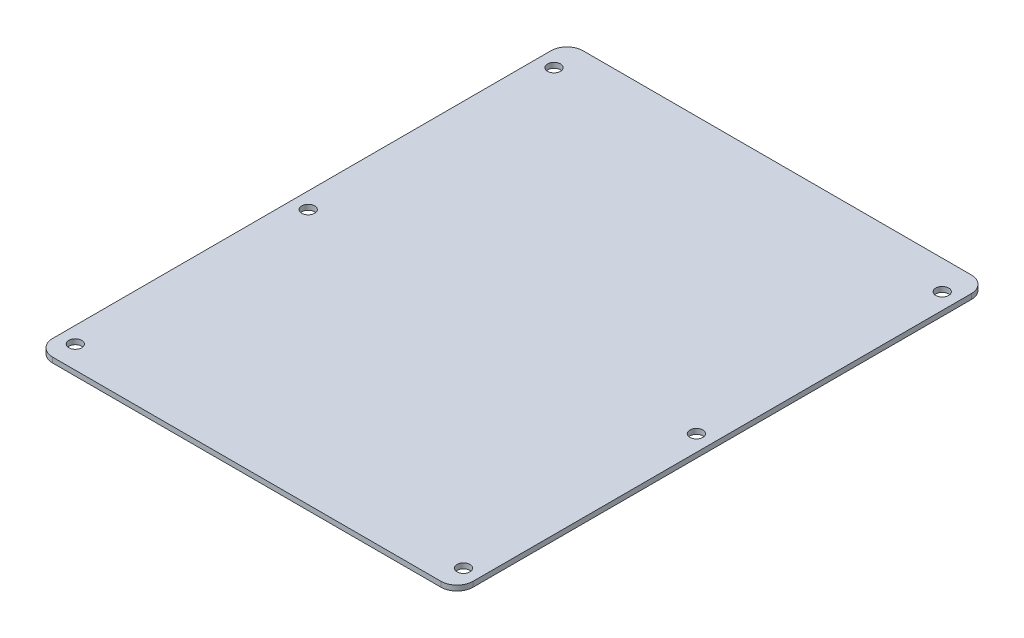
from build123d import *

# Parameters (mm, degrees)
ESQUISSE1_W             = 130
ESQUISSE1_H             = 164
BOSS_EXTRU_1_DEPTH      = 1.6
ESQUISSE2_R             = 2
ENL_V_MAT_EXTRU_1_DEPTH = 105.649701385
CONG_1_R                = 5


with BuildPart() as part:
    # Esquisse1 → Boss.-Extru.1 (new body)
    with BuildSketch(Plane(origin=(0, 0, 0), x_dir=(1, 0, 0), z_dir=(0, 1, 0))):
        Rectangle(ESQUISSE1_W, ESQUISSE1_H)
    extrude(amount=BOSS_EXTRU_1_DEPTH)

    # Esquisse2 → Enlèv. mat.-Extru.1 (cut, through all)
    with BuildSketch(Plane(origin=(0, 1.6, 0), x_dir=(1, 0, 0), z_dir=(0, 1, 0))):
        with Locations(Location((-60, 73, 0), (0, 0, 270))):
            Circle(ESQUISSE2_R)
        with Locations(Location((-60, -3, 0), (0, 0, 270))):
            Circle(ESQUISSE2_R)
        with Locations(Location((-60, -75, 0), (0, 0, 270))):
            Circle(ESQUISSE2_R)
        with Locations(Location((60, -75, 0), (0, 0, 90))):
            Circle(ESQUISSE2_R)
        with Locations(Location((60, -3, 0), (0, 0, 90))):
            Circle(ESQUISSE2_R)
        with Locations(Location((60, 73, 0), (0, 0, 90))):
            Circle(ESQUISSE2_R)
    extrude(amount=-ENL_V_MAT_EXTRU_1_DEPTH, mode=Mode.SUBTRACT)

    # Congé1
    cong_1_edges = [part.edges().sort_by_distance(p)[0] for p in [
        (65, 0.8, 82),
        (-65, 0.8, 82),
        (-65, 0.8, -82),
        (65, 0.8, -82),
    ]]
    fillet(cong_1_edges, radius=CONG_1_R)


solid = part.part
